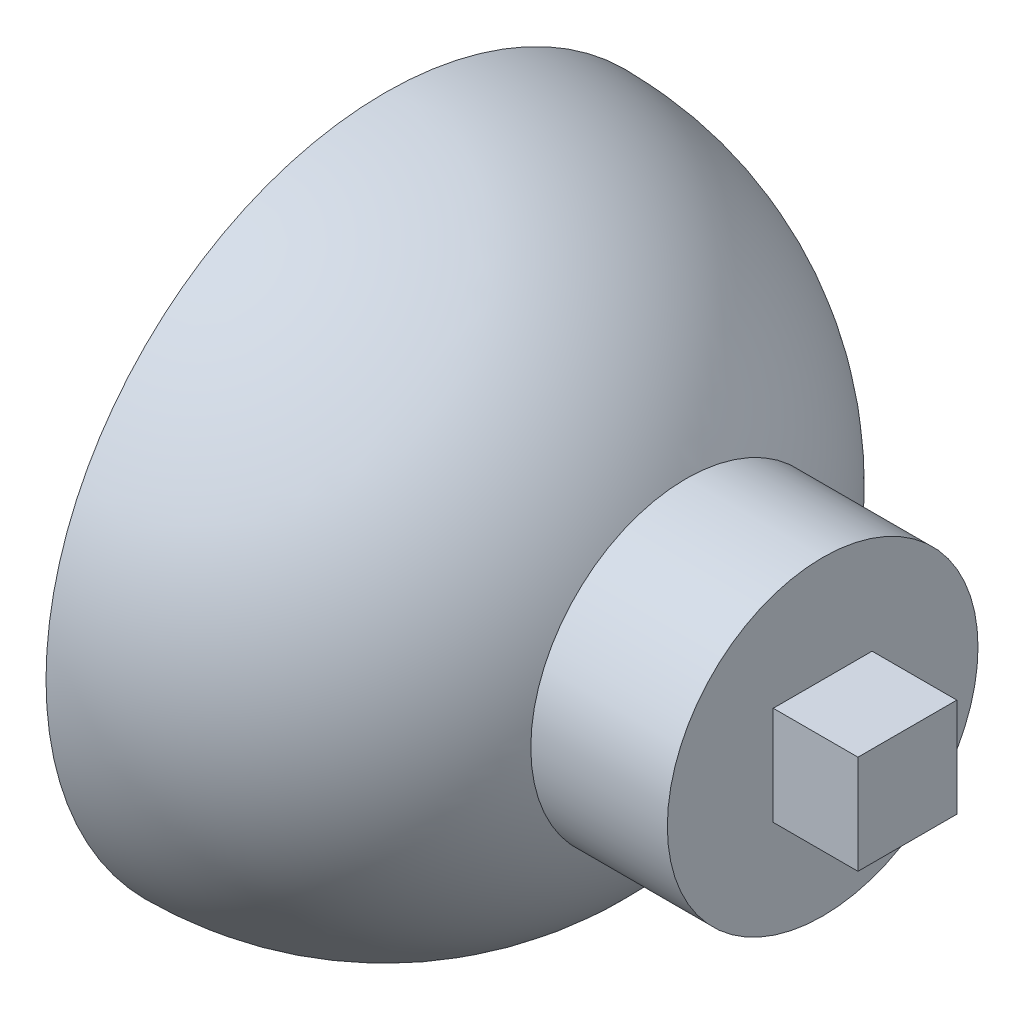
from build123d import *

# Parameters (mm, degrees)
BOSS_EXTRUDE1_START             = -30
SKETCH2_R                       = 11
BOSS_EXTRUDE1_DEPTH             = 1
BOSS_EXTRUDE1_DIRECTION_2_REACH = 73.569
SKETCH4_W                       = 7
SKETCH4_H                       = 7
BOSS_EXTRUDE2_DEPTH             = 6


with BuildPart() as part:
    # Sketch1 → Revolve-Thin1 (revolve)
    with BuildSketch(Plane.XY):
        with BuildLine():
            ThreePointArc((20, 0), (14.142135624, 14.142135624), (0, 20))
            Line((0, 20), (0, 24))
            ThreePointArc((0, 24), (16.970562748, 16.970562748), (24, 0))
            Line((24, 0), (20, 0))
        make_face()
    revolve(axis=Axis((0, 0, 0), (1, 0, 0)))

    # Sketch2 → Boss-Extrude1 (add)
    with BuildSketch(Plane.ZY.offset(BOSS_EXTRUDE1_START)):
        Circle(SKETCH2_R)
    extrude(amount=-BOSS_EXTRUDE1_DEPTH)

    # Sketch2 → Boss-Extrude1 direction 2 (add, up to next)
    with BuildSketch(Plane.ZY.offset(BOSS_EXTRUDE1_START), mode=Mode.PRIVATE) as boss_extrude1_direction_2_sk1:
        Circle(SKETCH2_R)
    boss_extrude1_direction_2_tool1 = extrude(boss_extrude1_direction_2_sk1.sketch, amount=BOSS_EXTRUDE1_DIRECTION_2_REACH, mode=Mode.PRIVATE) - part.part
    add(boss_extrude1_direction_2_tool1.solids().sort_by_distance((30, 0, 0))[0])

    # Sketch4 → Boss-Extrude2 (add)
    with BuildSketch(Plane(origin=(31, 0, 0), x_dir=(0, 0, -1), z_dir=(1, 0, 0))):
        Rectangle(SKETCH4_W, SKETCH4_H)
    extrude(amount=BOSS_EXTRUDE2_DEPTH)


solid = part.part
